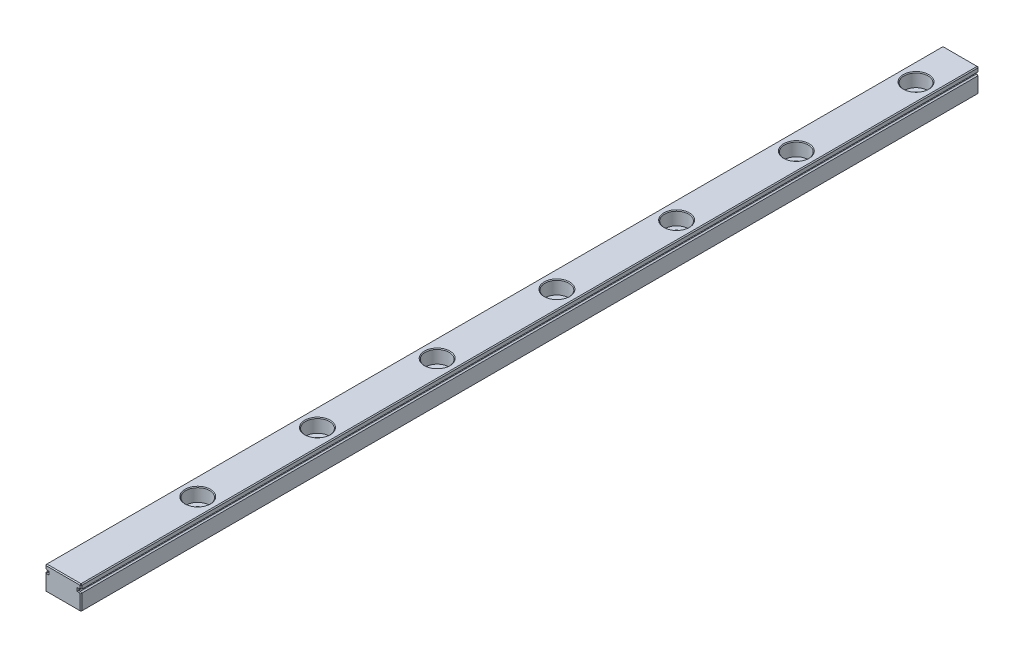
from build123d import *

# Parameters (mm, degrees)
BOSS_EXTRUDE1_DEPTH = 300
CHAMFER1_SIZE       = 0.3
LPATTERN1_COUNT     = 7
LPATTERN1_PITCH     = 40


with BuildPart() as part:
    # Sketch1 → Boss-Extrude1 (new body)
    with BuildSketch(Plane.XY):
        with BuildLine():
            Line((0, 8), (12, 8))
            Line((12, 8), (12, 6.75))
            Line((12, 6.75), (12, 6.559016994))
            ThreePointArc((12, 6.559016994), (11.706107374, 6.475528258), (11.5, 6.25))
            Line((11.5, 6.25), (11, 6.25))
            Line((11, 6.25), (11, 5.75))
            Line((11, 5.75), (11.5, 5.75))
            ThreePointArc((11.5, 5.75), (11.706107374, 5.524471742), (12, 5.440983006))
            Line((12, 5.440983006), (12, 5.25))
            Line((12, 5.25), (12, 0))
            Line((12, 0), (0, 0))
            Line((0, 0), (0, 5.25))
            Line((0, 5.25), (0, 5.440983006))
            ThreePointArc((0, 5.440983006), (0.293892626, 5.524471742), (0.5, 5.75))
            Line((0.5, 5.75), (1, 5.75))
            Line((1, 5.75), (1, 6.25))
            Line((1, 6.25), (0.5, 6.25))
            ThreePointArc((0.5, 6.25), (0.293892626, 6.475528258), (0, 6.559016994))
            Line((0, 6.559016994), (0, 6.75))
            Line((0, 6.75), (0, 8))
        make_face()
    extrude(amount=BOSS_EXTRUDE1_DEPTH)

    # Chamfer1
    chamfer1_edges = [part.edges().sort_by_distance(p)[0] for p in [
        (12, 2.720491503, 300),
        (11.706107374, 5.524471742, 300),
        (0, 2.720491503, 0),
        (0.293892626, 5.524471742, 0),
        (0.75, 5.75, 0),
        (1, 6, 0),
        (0.75, 6.25, 0),
        (11.25, 5.75, 300),
        (0.293892626, 6.475528258, 0),
        (0, 7.279508497, 0),
        (6, 8, 0),
        (12, 7.279508497, 0),
        (11.706107374, 6.475528258, 0),
        (11, 6, 300),
        (11.25, 6.25, 0),
        (11, 6, 0),
        (11.25, 5.75, 0),
        (11.706107374, 5.524471742, 0),
        (12, 2.720491503, 0),
        (6, 0, 0),
        (11.25, 6.25, 300),
        (11.706107374, 6.475528258, 300),
        (12, 7.279508497, 300),
        (0, 8, 150),
        (12, 8, 150),
        (12, 0, 150),
        (0, 0, 150),
        (6, 8, 300),
        (0, 2.720491503, 300),
        (0, 7.279508497, 300),
        (0.293892626, 6.475528258, 300),
        (0.75, 6.25, 300),
        (1, 6, 300),
        (0.75, 5.75, 300),
        (0.293892626, 5.524471742, 300),
        (6, 0, 300),
    ]]
    chamfer(chamfer1_edges, length=CHAMFER1_SIZE)

    # Sketch3 → CBORE for M5 Hex Head Bolt1 (revolve, cut)
    with BuildSketch(Plane(origin=(6, 8, 15), x_dir=(0, 0, 1), z_dir=(1, 0, 0))):
        Polygon((0, 0), (0, 8), (2.5, 8), (2.25, 7.75), (2.25, 4.5), (4, 4.5), (4, 0.25), (4.25, 0), align=None)
    cbore_for_m5_hex_head_bolt1 = revolve(axis=Axis((6, 14.35, 15), (0, -1, 0)), mode=Mode.SUBTRACT)

    # LPattern1: CBORE for M5 Hex Head Bolt1 ×7
    with Locations(*[(0, 0, i * LPATTERN1_PITCH) for i in range(1, LPATTERN1_COUNT)]):
        add(cbore_for_m5_hex_head_bolt1, mode=Mode.SUBTRACT)


solid = part.part
